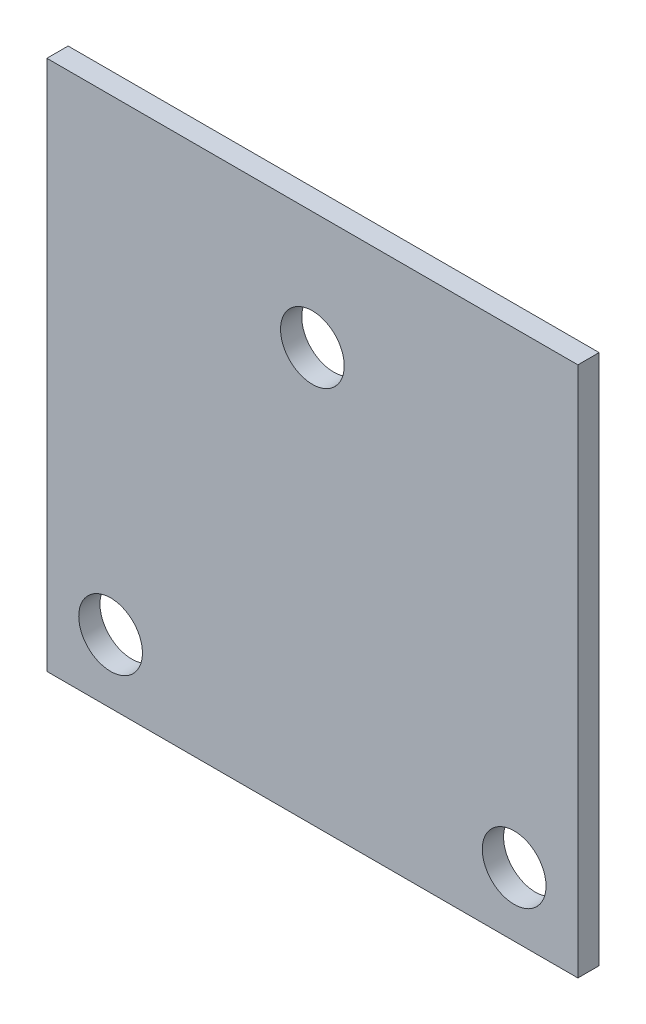
from build123d import *

# Parameters (mm, degrees)
SKETCH_1_W      = 25
SKETCH_1_H      = 25
SKETCH_1_R      = 1.5
EXTRUDE_1_DEPTH = 1


with BuildPart() as part:
    # 草图1 → 凸台-拉伸1 (new body)
    with BuildSketch(Plane.XY):
        Rectangle(SKETCH_1_W, SKETCH_1_H)
        with Locations((9.5, -9.5)):
            Circle(SKETCH_1_R, mode=Mode.SUBTRACT)
        with Locations(Location((-9.5, -9.5, 0), (0, 0, 180))):
            Circle(SKETCH_1_R, mode=Mode.SUBTRACT)
        with Locations((0, 6.954482672)):
            Circle(SKETCH_1_R, mode=Mode.SUBTRACT)
    extrude(amount=EXTRUDE_1_DEPTH)


solid = part.part
